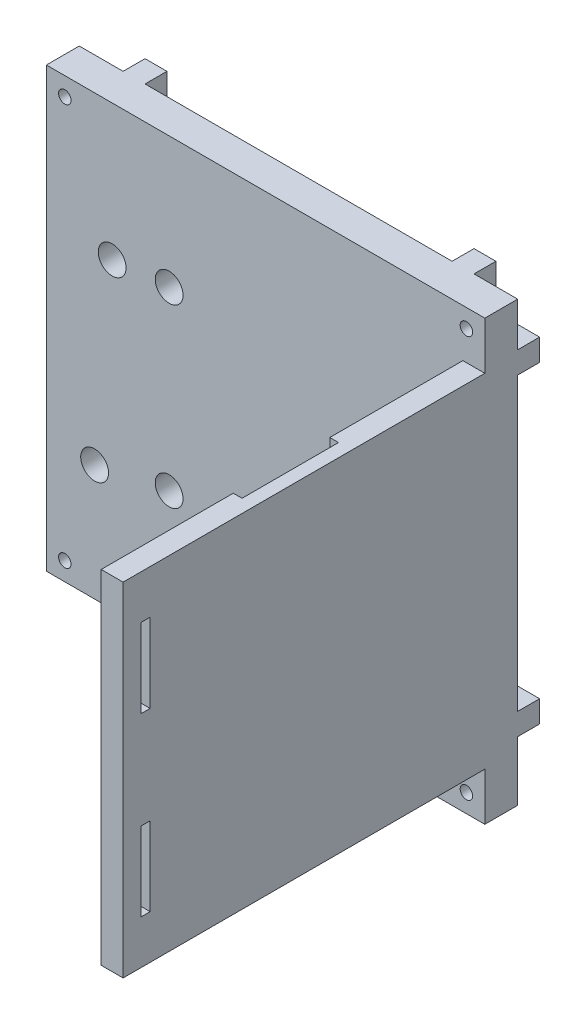
from build123d import *

# Parameters (mm, degrees)
ESQUISSE3_W             = 100
ESQUISSE3_H             = 100
BOSS_EXTRU_1_DEPTH      = 7.5
ESQUISSE4_W             = 5
ESQUISSE4_H             = 5
BOSS_EXTRU_2_DEPTH      = 5
ESQUISSE5_R             = 3.175
ESQUISSE5_R_2           = 1.42
ENL_V_MAT_EXTRU_1_DEPTH = 10
BOSS_EXTRU_3_DEPTH      = 82.5
ENL_V_MAT_EXTRU_2_DEPTH = 2
ESQUISSE8_W             = 17.977516738
ESQUISSE8_H             = 17.952716394
ESQUISSE8_H_2           = 18.02477834
ENL_V_MAT_EXTRU_3_DEPTH = 2
ESQUISSE10_W            = 2.045095135
ESQUISSE10_H            = 18.02477834
ESQUISSE10_H_2          = 17.952716394
ENL_V_MAT_EXTRU_4_DEPTH = 10


with BuildPart() as part:
    # Esquisse3 → Boss.-Extru.1 (new body)
    with BuildSketch(Plane.XY):
        Rectangle(ESQUISSE3_W, ESQUISSE3_H)
    extrude(amount=-BOSS_EXTRU_1_DEPTH)

    # Esquisse4 → Boss.-Extru.2 (add)
    with BuildSketch(Plane(origin=(0, 0, -7.5), x_dir=(-1, 0, 0), z_dir=(0, 0, -1))):
        with Locations((-37.534911535, 47.5)):
            Rectangle(ESQUISSE4_W, ESQUISSE4_H)
        with Locations((37.5, 47.5)):
            Rectangle(ESQUISSE4_W, ESQUISSE4_H)
        with Locations((47.5, 37.5)):
            Rectangle(ESQUISSE4_W, ESQUISSE4_H)
        with Locations((47.5, -37.5)):
            Rectangle(ESQUISSE4_W, ESQUISSE4_H)
        with Locations((37.5, -47.5)):
            Rectangle(ESQUISSE4_W, ESQUISSE4_H)
        with Locations((-37.534911535, -47.5)):
            Rectangle(ESQUISSE4_W, ESQUISSE4_H)
        with Locations((-47.5, -33.92882297)):
            Rectangle(ESQUISSE4_W, ESQUISSE4_H)
        with Locations((-47.5, 37.5)):
            Rectangle(ESQUISSE4_W, ESQUISSE4_H)
    extrude(amount=BOSS_EXTRU_2_DEPTH)

    # Esquisse5 → Enlèv. mat.-Extru.1 (cut)
    with BuildSketch(Plane.XY):
        with Locations((-35, 19)):
            Circle(ESQUISSE5_R)
        with Locations((-39, -23.5)):
            Circle(ESQUISSE5_R)
        with Locations((-45.8, 45.8)):
            Circle(ESQUISSE5_R_2)
        with Locations((-45.8, -45.8)):
            Circle(ESQUISSE5_R_2)
        with Locations((45.8, -45.8)):
            Circle(ESQUISSE5_R_2)
        with Locations((45.8, 45.8)):
            Circle(ESQUISSE5_R_2)
        with Locations((-22, 20.1)):
            Circle(ESQUISSE5_R)
        with Locations((-22, -20.1)):
            Circle(ESQUISSE5_R)
    extrude(amount=-ENL_V_MAT_EXTRU_1_DEPTH, mode=Mode.SUBTRACT)

    # Esquisse6 → Boss.-Extru.3 (add)
    with BuildSketch(Plane.XY):
        Polygon((50, 0), (50, 39.1), (45, 39.1), (45, -39.1), (50, -39.1), align=None)
    extrude(amount=BOSS_EXTRU_3_DEPTH)

    # Esquisse7 → Enlèv. mat.-Extru.2 (cut)
    with BuildSketch(Plane.ZY.offset(-45)):
        Polygon((52.376358197, 39.1), (30.359102655, 39.1), (30.359102655, 31.140897345), (22.4, 31.09702268), (22.4, 9.07224434), (30.37224434, 9.07224434), (30.37224434, 1.1), (52.376358197, 1.1), (52.376358197, 9.123641803), (60.4, 9.07224434), (60.4, 31.09702268), (52.376358197, 31.076358197), align=None)
        Polygon((52.376358197, -1.1), (30.37224434, -1.1), (30.37224434, -9.07224434), (22.4, -9.07224434), (22.4, -31.079901273), (30.420098727, -31.079901273), (30.420098727, -39.1), (52.376358197, -39.1), (52.376358197, -31.076358197), (60.4, -31.076358197), (60.4, -9.123641803), (52.376358197, -9.123641803), align=None)
    extrude(amount=-ENL_V_MAT_EXTRU_2_DEPTH, mode=Mode.SUBTRACT)

    # Esquisse8 → Enlèv. mat.-Extru.3 (cut)
    with BuildSketch(Plane.ZY.offset(-45)):
        with Locations((69.388758369, -20.1)):
            Rectangle(ESQUISSE8_W, ESQUISSE8_H)
        with Locations((69.388758369, 20.08463351)):
            Rectangle(ESQUISSE8_W, ESQUISSE8_H_2)
    extrude(amount=-ENL_V_MAT_EXTRU_3_DEPTH, mode=Mode.SUBTRACT)

    # Esquisse10 → Enlèv. mat.-Extru.4 (cut)
    with BuildSketch(Plane.ZY.offset(-47)):
        with Locations((77.35496917, 20.08463351)):
            Rectangle(ESQUISSE10_W, ESQUISSE10_H)
        with Locations((77.35496917, -20.1)):
            Rectangle(ESQUISSE10_W, ESQUISSE10_H_2)
    extrude(amount=-ENL_V_MAT_EXTRU_4_DEPTH, mode=Mode.SUBTRACT)


solid = part.part
